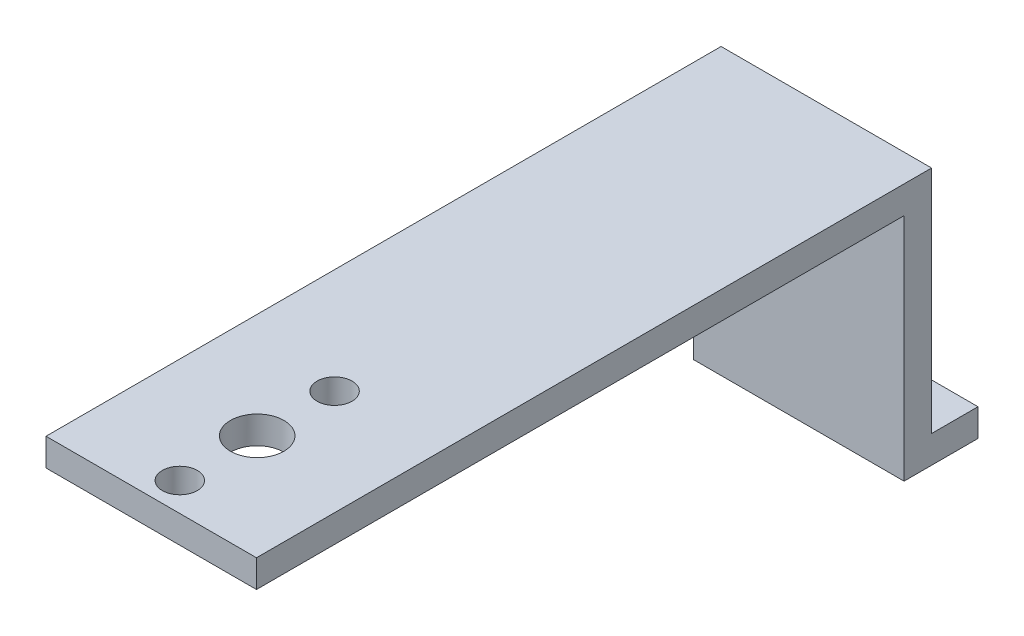
from build123d import *

# Parameters (mm, degrees)
BOSS_EXTRUDE1_DEPTH      = 6.8
BOSS_EXTRUDE1_DEPTH_BACK = 6.8
CUT_EXTRUDE1_REACH       = 48.357
SKETCH2_R                = 1.1303
SKETCH2_R_2              = 1.7272


with BuildPart() as part:
    # Sketch1 → Boss-Extrude1 (new, two sides: drawn at the far end of the back side and taken through both)
    with BuildSketch(Plane(origin=(0, 0, 0), x_dir=(0, 0, -1), z_dir=(1, 0, 0)).offset(-BOSS_EXTRUDE1_DEPTH_BACK)):
        Polygon((0.889, 3.903), (-0.889, 3.903), (-42.731, 3.903), (-42.731, 2.125), (-0.889, 2.125), (-0.889, -12.733), (3.889, -12.733), (3.889, -10.955), (0.889, -10.955), align=None)
    extrude(amount=BOSS_EXTRUDE1_DEPTH + BOSS_EXTRUDE1_DEPTH_BACK)

    # Sketch2 → Cut-Extrude1 (cut, up to next)
    with BuildSketch(Plane(origin=(0, 3.903, 0), x_dir=(1, 0, 0), z_dir=(0, 1, 0)), mode=Mode.PRIVATE) as cut_extrude1_sk1:
        with Locations((0, -40.8857)):
            Circle(SKETCH2_R)
    cut_extrude1_tool1 = extrude(cut_extrude1_sk1.sketch, amount=-CUT_EXTRUDE1_REACH, mode=Mode.PRIVATE) & part.part
    # Sketch2 → Cut-Extrude1 (cut, up to next)
    with BuildSketch(Plane(origin=(0, 3.903, 0), x_dir=(1, 0, 0), z_dir=(0, 1, 0)), mode=Mode.PRIVATE) as cut_extrude1_sk2:
        with Locations((0, -35.8857)):
            Circle(SKETCH2_R_2)
    cut_extrude1_tool2 = extrude(cut_extrude1_sk2.sketch, amount=-CUT_EXTRUDE1_REACH, mode=Mode.PRIVATE) & part.part
    # Sketch2 → Cut-Extrude1 (cut, up to next)
    with BuildSketch(Plane(origin=(0, 3.903, 0), x_dir=(1, 0, 0), z_dir=(0, 1, 0)), mode=Mode.PRIVATE) as cut_extrude1_sk3:
        with Locations((0, -30.8857)):
            Circle(SKETCH2_R)
    cut_extrude1_tool3 = extrude(cut_extrude1_sk3.sketch, amount=-CUT_EXTRUDE1_REACH, mode=Mode.PRIVATE) & part.part
    add(cut_extrude1_tool1.solids().sort_by_distance((0, 3.903, 40.8857))[0], mode=Mode.SUBTRACT)
    add(cut_extrude1_tool2.solids().sort_by_distance((0, 3.903, 35.8857))[0], mode=Mode.SUBTRACT)
    add(cut_extrude1_tool3.solids().sort_by_distance((0, 3.903, 30.8857))[0], mode=Mode.SUBTRACT)


solid = part.part
